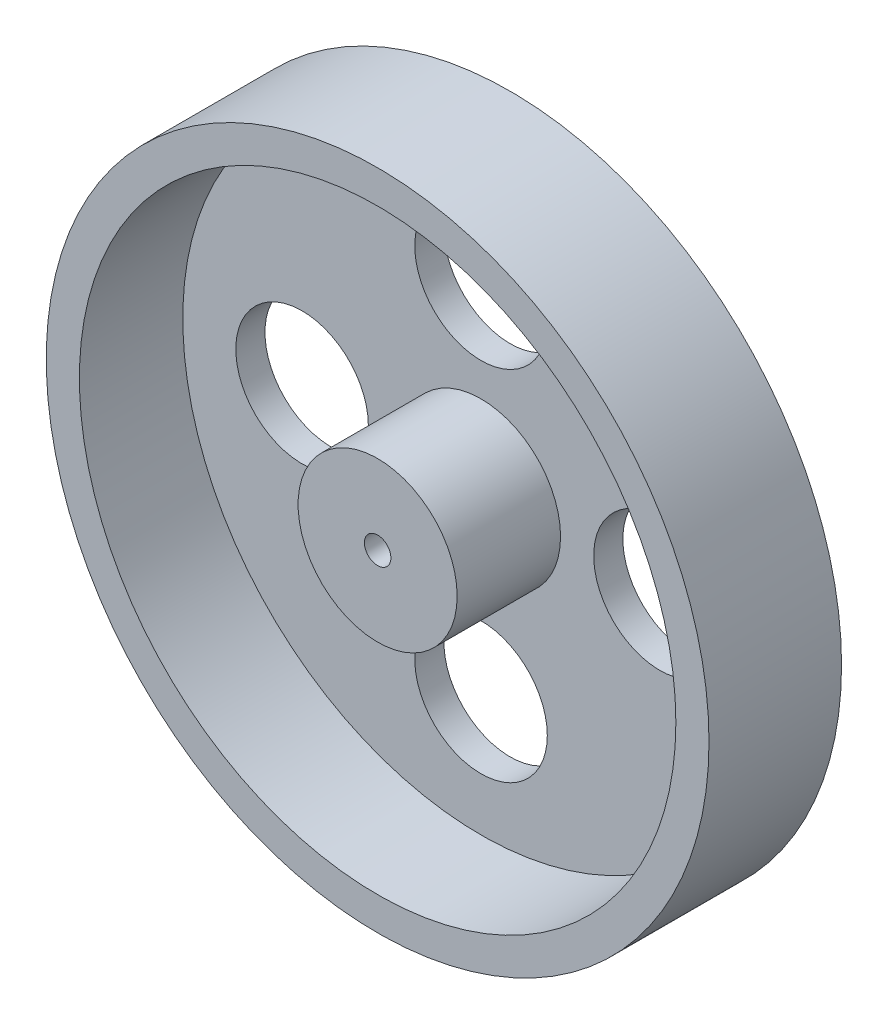
from build123d import *

# Parameters (mm, degrees)
SKETCH1_R                 = 25
WHEEL_WEB_50MM_DEPTH      = 2.2
OUTER_RIM_10MM_WIDE_START = 2.2
SKETCH2_R                 = 25
SKETCH2_R_2               = 22.5
OUTER_RIM_10MM_WIDE_DEPTH = 7.8
HUB_12MM_START            = 2.2
SKETCH3_R                 = 6
HUB_12MM_DEPTH            = 7.8
AXLE_BORE_FIT_CHECK_START = -0.1
SKETCH4_R                 = 1
AXLE_BORE_FIT_CHECK_DEPTH = 10.2
LIGHTENING_X_13_5_START   = -0.1
SKETCH5_R                 = 5
LIGHTENING_X_13_5_DEPTH   = 10.2
SKETCH6_R                 = 5
LIGHTENING_X_13_5_2_DEPTH = 10.2
LIGHTENING_Y_13_5_START   = -0.1
SKETCH7_R                 = 5
LIGHTENING_Y_13_5_DEPTH   = 10.2
SKETCH8_R                 = 5
LIGHTENING_Y_13_5_2_DEPTH = 10.2


with BuildPart() as part:
    # Sketch1 → Wheel_Web_50mm (new body)
    with BuildSketch(Plane.XY):
        Circle(SKETCH1_R)
    extrude(amount=WHEEL_WEB_50MM_DEPTH)

    # Sketch2 → Outer_Rim_10mm_Wide (add)
    with BuildSketch(Plane.XY.offset(OUTER_RIM_10MM_WIDE_START)):
        Circle(SKETCH2_R)
        Circle(SKETCH2_R_2, mode=Mode.SUBTRACT)
    extrude(amount=OUTER_RIM_10MM_WIDE_DEPTH)

    # Sketch3 → Hub_12mm (add)
    with BuildSketch(Plane.XY.offset(HUB_12MM_START)):
        Circle(SKETCH3_R)
    extrude(amount=HUB_12MM_DEPTH)

    # Sketch4 → Axle_Bore_FIT_CHECK (cut)
    with BuildSketch(Plane.XY.offset(AXLE_BORE_FIT_CHECK_START)):
        Circle(SKETCH4_R)
    extrude(amount=AXLE_BORE_FIT_CHECK_DEPTH, mode=Mode.SUBTRACT)

    # Sketch5 → Lightening_X_-13.5 (cut)
    with BuildSketch(Plane.XY.offset(LIGHTENING_X_13_5_START)):
        with Locations((-13.5, 0)):
            Circle(SKETCH5_R)
    extrude(amount=LIGHTENING_X_13_5_DEPTH, mode=Mode.SUBTRACT)

    # Sketch6 → Lightening_X_13.5 2 (cut)
    with BuildSketch(Plane.XY.offset(LIGHTENING_X_13_5_START)):
        with Locations((13.5, 0)):
            Circle(SKETCH6_R)
    extrude(amount=LIGHTENING_X_13_5_2_DEPTH, mode=Mode.SUBTRACT)

    # Sketch7 → Lightening_Y_-13.5 (cut)
    with BuildSketch(Plane.XY.offset(LIGHTENING_Y_13_5_START)):
        with Locations((0, -13.5)):
            Circle(SKETCH7_R)
    extrude(amount=LIGHTENING_Y_13_5_DEPTH, mode=Mode.SUBTRACT)

    # Sketch8 → Lightening_Y_13.5 2 (cut)
    with BuildSketch(Plane.XY.offset(LIGHTENING_Y_13_5_START)):
        with Locations((0, 13.5)):
            Circle(SKETCH8_R)
    extrude(amount=LIGHTENING_Y_13_5_2_DEPTH, mode=Mode.SUBTRACT)


solid = part.part
